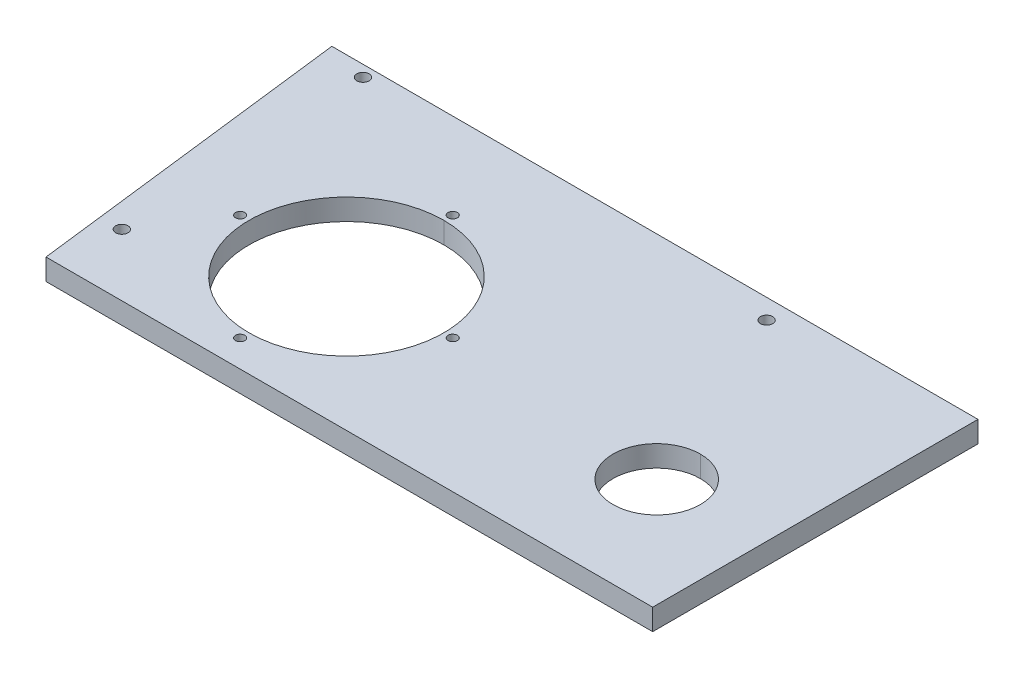
from build123d import *

# Parameters (mm, degrees)
SKETCH1_R             = 52.3875
SKETCH1_R_2           = 23.5
BOSS_EXTRUDE1_DEPTH   = 11.43
M6_CLEARANCE_HOLE1_D  = 6.6
F_5_0MM_DOWEL_HOLE1_D = 5
CIRPATTERN1_COUNT     = 4


with BuildPart() as part:
    # Sketch1 → Boss-Extrude1 (new body)
    with BuildSketch(Plane(origin=(0, 0, 0), x_dir=(1, 0, 0), z_dir=(0, 1, 0))):
        Polygon((-234.329030184, -12.7), (113.061428613, -12.7), (113.061428613, -187.604888893), (-213.064788009, -187.65872147), align=None)
        with Locations(Location((-123.19, -116.001477372, 0), (0, 0, 270))):
            Circle(SKETCH1_R, mode=Mode.SUBTRACT)
        with Locations(Location((54.61, -127, 0), (0, 0, 270))):
            Circle(SKETCH1_R_2, mode=Mode.SUBTRACT)
    extrude(amount=BOSS_EXTRUDE1_DEPTH)

    # M6 Clearance Hole1 (through all)
    with Locations(Plane(origin=(0, 0, 0), x_dir=(-1, 0, 0), z_dir=(0, -1, 0))):
        with Locations((-10.033704867, -23.334197365), (211.518182886, -18.798178744), (205.575185514, -154.375359311)):
            Hole(M6_CLEARANCE_HOLE1_D / 2)

    # Ø5.0mm Dowel Hole1 (through all)
    with Locations(Plane(origin=(0, 0, 0), x_dir=(-1, 0, 0), z_dir=(0, -1, 0))):
        with Locations((123.19, -173.151477372)):
            f_5_0mm_dowel_hole1 = Hole(F_5_0MM_DOWEL_HOLE1_D / 2)

    # CirPattern1: Ø5.0mm Dowel Hole1 ×4 about axis
    cirpattern1_axis = Axis((-123.19, 0, 116.001477372), (0, 1, 0))
    for i in range(1, CIRPATTERN1_COUNT):
        add(f_5_0mm_dowel_hole1.rotate(cirpattern1_axis, i * 360 / CIRPATTERN1_COUNT), mode=Mode.SUBTRACT)


solid = part.part
